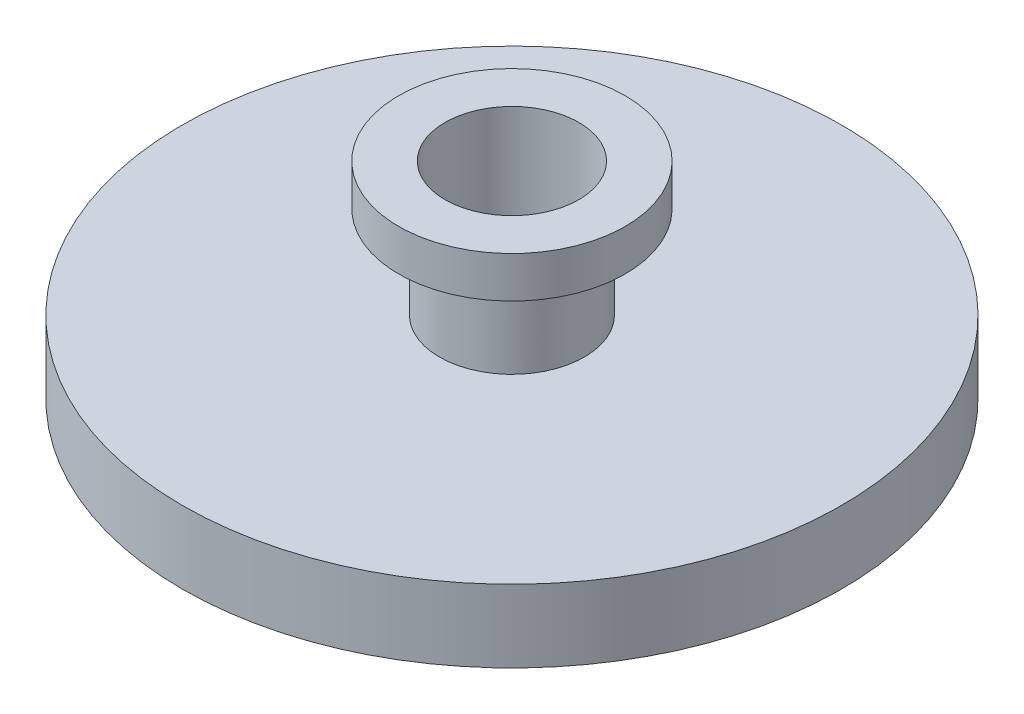
from build123d import *

# Parameters (mm, degrees)
SKETCH1_R           = 101.6
BOSS_EXTRUDE1_DEPTH = 22.352
SKETCH2_R           = 34.925
BOSS_EXTRUDE2_DEPTH = 12.7
SKETCH3_R           = 22.352
BOSS_EXTRUDE3_DEPTH = 41.148
SKETCH4_R           = 20.6375
CUT_EXTRUDE1_DEPTH  = 158.090324336


with BuildPart() as part:
    # Sketch1 → Boss-Extrude1 (new body)
    with BuildSketch(Plane(origin=(0, 0, 0), x_dir=(1, 0, 0), z_dir=(0, 1, 0))):
        with Locations(Location((0, 0, 0), (0, 0, 270))):
            Circle(SKETCH1_R)
    extrude(amount=BOSS_EXTRUDE1_DEPTH)



with BuildPart() as body_2:
    # Sketch2 → Boss-Extrude2 (new body)
    with BuildSketch(Plane.XZ.offset(-63.5)):
        with Locations(Location((0, 0, 0), (0, 0, 270))):
            Circle(SKETCH2_R)
    extrude(amount=BOSS_EXTRUDE2_DEPTH)


with BuildPart() as part_1:
    add(part.part)

    add(body_2.part)  # Boss-Extrude3 merges body 2
    # Sketch3 → Boss-Extrude3 (add)
    with BuildSketch(Plane(origin=(0, 63.5, 0), x_dir=(1, 0, 0), z_dir=(0, 1, 0))):
        with Locations(Location((0, 0, 0), (0, 0, 270))):
            Circle(SKETCH3_R)
    extrude(amount=-BOSS_EXTRUDE3_DEPTH)

    # Sketch4 → Cut-Extrude1 (cut, through all)
    with BuildSketch(Plane(origin=(0, 63.5, 0), x_dir=(1, 0, 0), z_dir=(0, 1, 0))):
        with Locations(Location((0, 0, 0), (0, 0, 270))):
            Circle(SKETCH4_R)
    extrude(amount=-CUT_EXTRUDE1_DEPTH, mode=Mode.SUBTRACT)


solid = part_1.part
